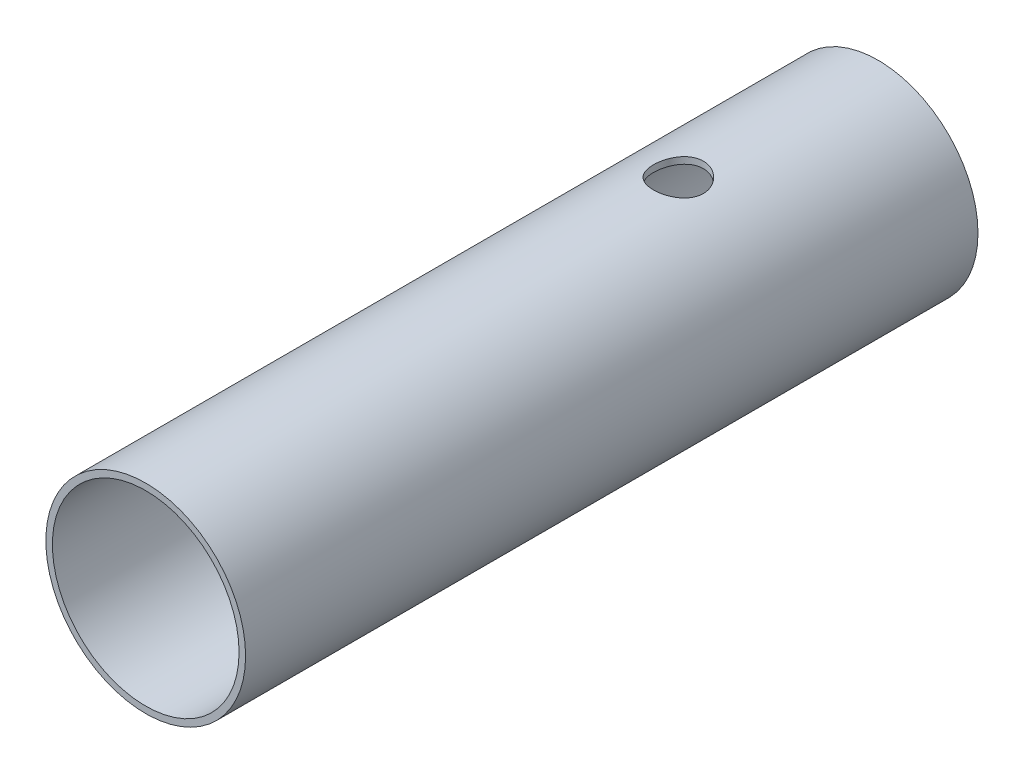
from build123d import *

# Parameters (mm, degrees)
SKETCH3_R           = 19.05
SKETCH3_R_2         = 17.8054
BOSS_EXTRUDE1_DEPTH = 69.85
SKETCH4_R           = 4.7625
CUT_EXTRUDE1_DEPTH  = 85.957209818


with BuildPart() as part:
    # Sketch3 → Boss-Extrude1 (new, symmetric)
    with BuildSketch(Plane.XY):
        Circle(SKETCH3_R)
        Circle(SKETCH3_R_2, mode=Mode.SUBTRACT)
    extrude(amount=BOSS_EXTRUDE1_DEPTH, both=True)

    # Sketch4 → Cut-Extrude1 (cut, through all)
    with BuildSketch(Plane(origin=(0, 25.4, 0), x_dir=(1, 0, 0), z_dir=(0, 1, 0))):
        with Locations(Location((0, 31.75, 0), (0, 0, 270))):
            Circle(SKETCH4_R)
    extrude(amount=-CUT_EXTRUDE1_DEPTH, mode=Mode.SUBTRACT)


solid = part.part
